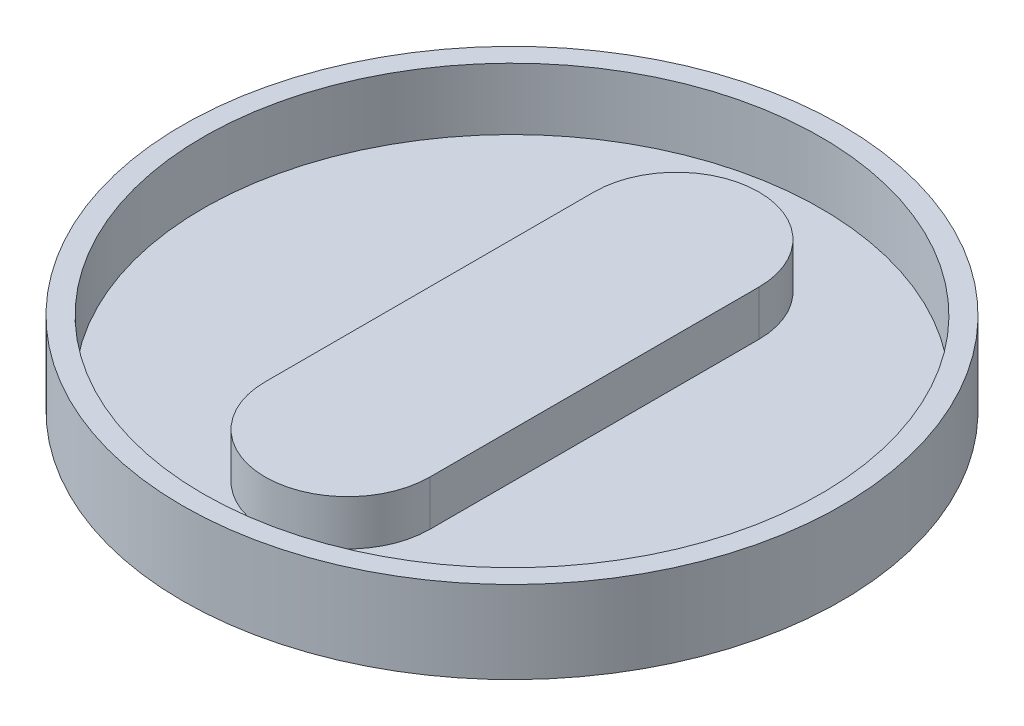
from build123d import *

# Parameters (mm, degrees)
SKETCH1_R           = 101.6
BOSS_EXTRUDE1_DEPTH = 25.4
SKETCH3_R           = 95.25
CUT_EXTRUDE1_DEPTH  = 19.05
BOSS_EXTRUDE2_DEPTH = 13.97


with BuildPart() as part:
    # Sketch1 → Boss-Extrude1 (new body)
    with BuildSketch(Plane(origin=(0, 0, 0), x_dir=(1, 0, 0), z_dir=(0, 1, 0))):
        with Locations(Location((0, 0, 0), (0, 0, 270))):
            Circle(SKETCH1_R)
    extrude(amount=BOSS_EXTRUDE1_DEPTH)

    # Sketch3 → Cut-Extrude1 (cut)
    with BuildSketch(Plane(origin=(0, 25.4, 0), x_dir=(1, 0, 0), z_dir=(0, 1, 0))):
        with Locations(Location((0, 0, 0), (0, 0, 270))):
            Circle(SKETCH3_R)
    extrude(amount=-CUT_EXTRUDE1_DEPTH, mode=Mode.SUBTRACT)

    # Sketch5 → Boss-Extrude2 (add)
    with BuildSketch(Plane(origin=(0, 6.35, 0), x_dir=(1, 0, 0), z_dir=(0, 1, 0))):
        with BuildLine():
            Line((-25.4, -50.707939874), (-25.4, 50.707939874))
            ThreePointArc((-25.4, 50.707939874), (0, 76.107939874), (25.4, 50.707939874))
            Line((25.4, 50.707939874), (25.4, -50.707939874))
            ThreePointArc((25.4, -50.707939874), (0, -76.107939874), (-25.4, -50.707939874))
        make_face()
    extrude(amount=BOSS_EXTRUDE2_DEPTH)


solid = part.part
